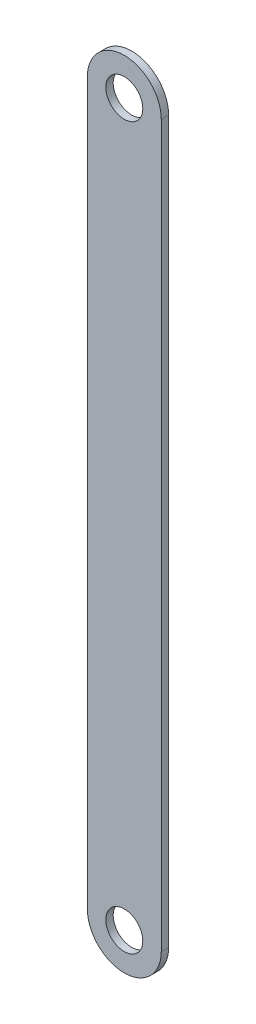
from build123d import *

# Parameters (mm, degrees)
SKETCH_1_R      = 2.5
EXTRUDE_1_DEPTH = 1


with BuildPart() as part:
    # Эскиз1 → Бобышка-Вытянуть1 (new body)
    with BuildSketch(Plane.XY):
        with BuildLine():
            Line((-5, 97.5), (-5, 0))
            ThreePointArc((-5, 0), (0, -5), (5, 0))
            Line((5, 0), (5, 97.5))
            ThreePointArc((5, 97.5), (0, 102.5), (-5, 97.5))
        make_face()
        Circle(SKETCH_1_R, mode=Mode.SUBTRACT)
        with Locations((0, 97.5)):
            Circle(SKETCH_1_R, mode=Mode.SUBTRACT)
    extrude(amount=EXTRUDE_1_DEPTH)


solid = part.part
